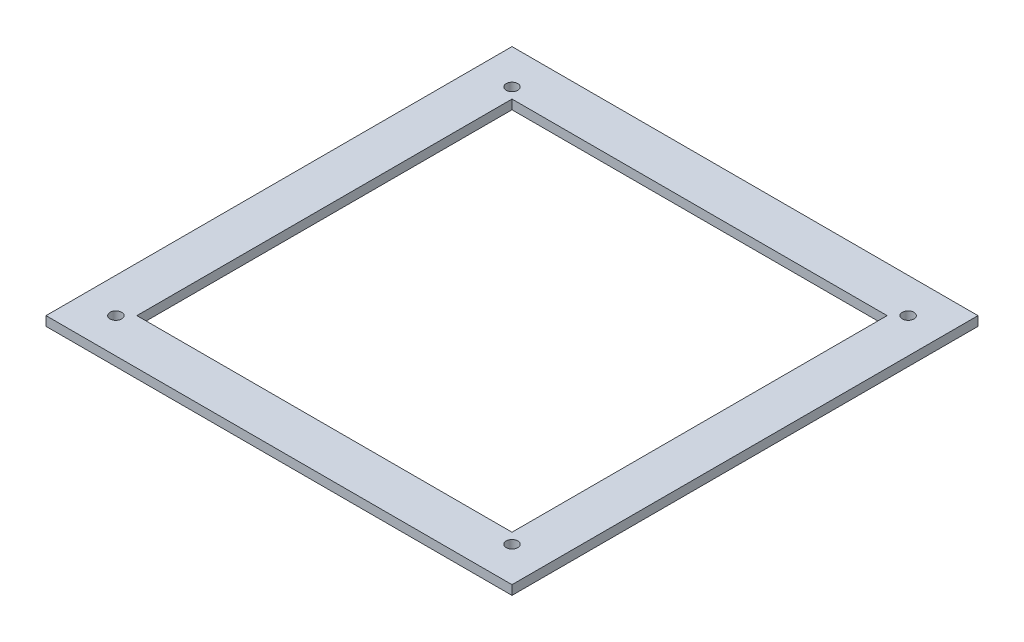
from build123d import *

# Parameters (mm, degrees)
CROQUIS1_W              = 200
CROQUIS1_H              = 200
CROQUIS1_R              = 2.5
SALIENTE_EXTRUIR1_DEPTH = 4
CROQUIS2_W              = 158
CROQUIS2_H              = 158
CORTAR_EXTRUIR1_DEPTH   = 10
CROQUIS3_W              = 161
CROQUIS3_H              = 161
CORTAR_EXTRUIR2_DEPTH   = 10


with BuildPart() as part:
    # Croquis1 → Saliente-Extruir1 (new body)
    with BuildSketch(Plane(origin=(0, 0, 0), x_dir=(1, 0, 0), z_dir=(0, 1, 0))):
        with Locations((100, 100)):
            Rectangle(CROQUIS1_W, CROQUIS1_H)
        with Locations(Location((15, 185, 0), (0, 0, 270))):
            Circle(CROQUIS1_R, mode=Mode.SUBTRACT)
        with Locations(Location((185, 185, 0), (0, 0, 270))):
            Circle(CROQUIS1_R, mode=Mode.SUBTRACT)
        with Locations(Location((185, 15, 0), (0, 0, 270))):
            Circle(CROQUIS1_R, mode=Mode.SUBTRACT)
        with Locations(Location((15, 15, 0), (0, 0, 270))):
            Circle(CROQUIS1_R, mode=Mode.SUBTRACT)
    extrude(amount=SALIENTE_EXTRUIR1_DEPTH)

    # Croquis2 → Cortar-Extruir1 (cut)
    with BuildSketch(Plane(origin=(0, 4, 0), x_dir=(1, 0, 0), z_dir=(0, 1, 0))):
        with Locations((100, 100)):
            Rectangle(CROQUIS2_W, CROQUIS2_H)
    extrude(amount=-CORTAR_EXTRUIR1_DEPTH, mode=Mode.SUBTRACT)

    # Croquis3 → Cortar-Extruir2 (cut)
    with BuildSketch(Plane(origin=(0, 4, 0), x_dir=(1, 0, 0), z_dir=(0, 1, 0))):
        with Locations((100, 100)):
            Rectangle(CROQUIS3_W, CROQUIS3_H)
    extrude(amount=-CORTAR_EXTRUIR2_DEPTH, mode=Mode.SUBTRACT)


solid = part.part
